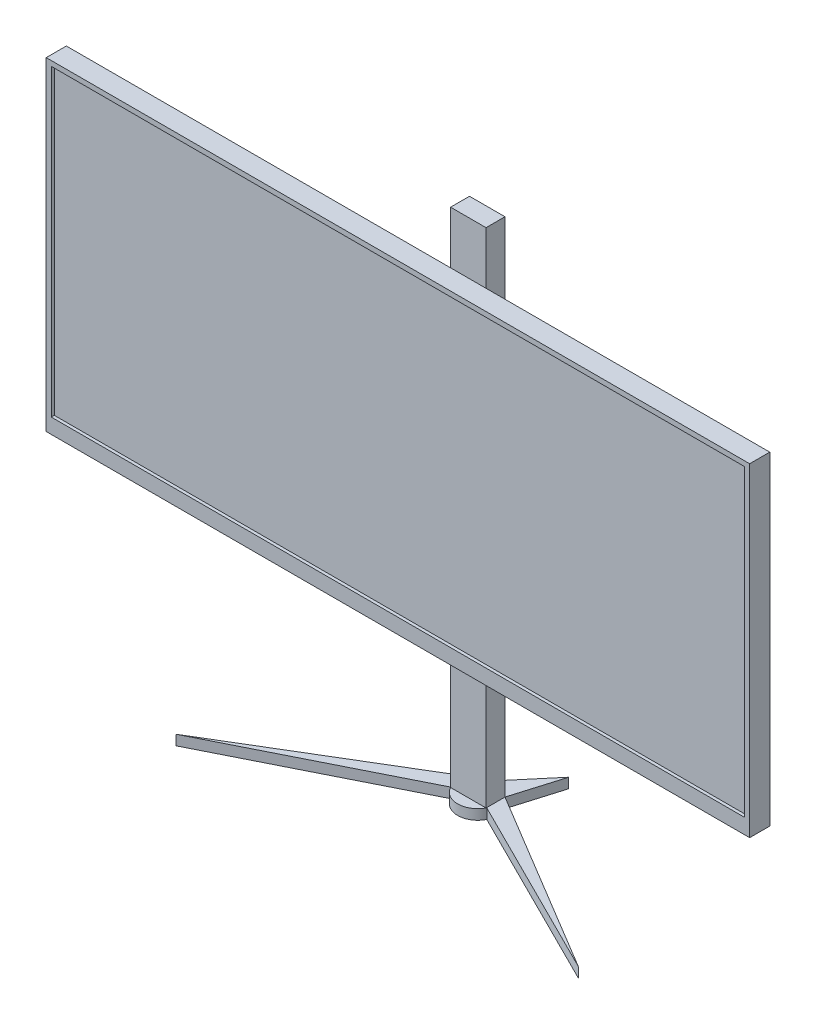
from build123d import *

# Parameters (mm, degrees)
BOSS_EXTRUDE1_DEPTH = 10
SKETCH6_W           = 35.294117648
SKETCH6_H           = 18.823529412
BOSS_EXTRUDE3_DEPTH = 500
SKETCH8_W           = 35.294117648
SKETCH8_H           = 20.234009988
BOSS_EXTRUDE4_DEPTH = 50
SKETCH9_W           = 699.8
SKETCH9_H           = 322.2
BOSS_EXTRUDE5_DEPTH = 20
SKETCH10_W          = 689.8
SKETCH10_H          = 302.2
CUT_EXTRUDE1_DEPTH  = 3
CUT_EXTRUDE6_DEPTH  = 5
SKETCH13_W          = 100
SKETCH13_H          = 20
CUT_EXTRUDE7_DEPTH  = 2


with BuildPart() as part:
    # Sketch1 → Boss-Extrude1 (new body)
    with BuildSketch(Plane(origin=(0, 0, 0), x_dir=(1, 0, 0), z_dir=(0, 1, 0))):
        with BuildLine():
            Line((0, 0), (182.11145618, 91.05572809))
            ThreePointArc((182.11145618, 91.05572809), (200, 80), (217.88854382, 91.05572809))
            Line((217.88854382, 91.05572809), (400, 0))
            Line((400, 0), (217.647058824, 109.411764706))
            Line((217.647058824, 109.411764706), (232.214563867, 158.239009858))
            Line((232.214563867, 158.239009858), (200, 120))
            Line((200, 120), (167.785436133, 158.239009858))
            Line((167.785436133, 158.239009858), (182.352941176, 109.411764706))
            Line((182.352941176, 109.411764706), (0, 0))
        make_face()
    extrude(amount=BOSS_EXTRUDE1_DEPTH)

    # Sketch6 → Boss-Extrude3 (add)
    with BuildSketch(Plane(origin=(0, 10, 0), x_dir=(1, 0, 0), z_dir=(0, 1, 0))):
        with Locations((200, 100)):
            Rectangle(SKETCH6_W, SKETCH6_H)
    extrude(amount=BOSS_EXTRUDE3_DEPTH)

    # Sketch8 → Boss-Extrude4 (add)
    with BuildSketch(Plane.XY.offset(-90.588235294)):
        with Locations((200, 346.635085086)):
            Rectangle(SKETCH8_W, SKETCH8_H)
    extrude(amount=BOSS_EXTRUDE4_DEPTH)

    # Sketch9 → Boss-Extrude5 (add)
    with BuildSketch(Plane.XY.offset(-40.588235294)):
        with Locations((200, 346.635085086)):
            Rectangle(SKETCH9_W, SKETCH9_H)
    extrude(amount=BOSS_EXTRUDE5_DEPTH)

    # Sketch10 → Cut-Extrude1 (cut)
    with BuildSketch(Plane.XY.offset(-20.588235294)):
        with Locations((200, 351.635085086)):
            Rectangle(SKETCH10_W, SKETCH10_H)
    extrude(amount=-CUT_EXTRUDE1_DEPTH, mode=Mode.SUBTRACT)

    # Sketch11 → Cut-Extrude6 (cut)
    with BuildSketch(Plane(origin=(0, 0, -40.588235294), x_dir=(-1, 0, 0), z_dir=(0, 0, -1))):
        Polygon((-392.933529412, 226.955085086), (-392.933529412, 225.535085086), (-403.353529412, 225.535085086), (-403.353529412, 226.955085086), (-402.353529412, 227.955085086), (-393.933529412, 227.955085086), align=None)
        Polygon((-366.833529412, 225.535085086), (-366.833529412, 229.295085086), (-367.833529412, 230.295085086), (-382.933529412, 230.295085086), (-382.933529412, 225.535085086), align=None)
        Polygon((-341.733529412, 230.295085086), (-340.733529412, 229.295085086), (-340.733529412, 225.535085086), (-356.833529412, 225.535085086), (-356.833529412, 230.295085086), align=None)
        Polygon((-423.773529412, 226.955085086), (-423.773529412, 225.535085086), (-413.353529412, 225.535085086), (-413.353529412, 226.955085086), (-414.353529412, 227.955085086), (-422.773529412, 227.955085086), align=None)
    extrude(amount=-CUT_EXTRUDE6_DEPTH, mode=Mode.SUBTRACT)

    # Sketch13 → Cut-Extrude7 (cut)
    with BuildSketch(Plane(origin=(0, 0, -40.588235294), x_dir=(-1, 0, 0), z_dir=(0, 0, -1))):
        with Locations((-379.9, 224.097206675)):
            Rectangle(SKETCH13_W, SKETCH13_H)
    extrude(amount=-CUT_EXTRUDE7_DEPTH, mode=Mode.SUBTRACT)


solid = part.part
